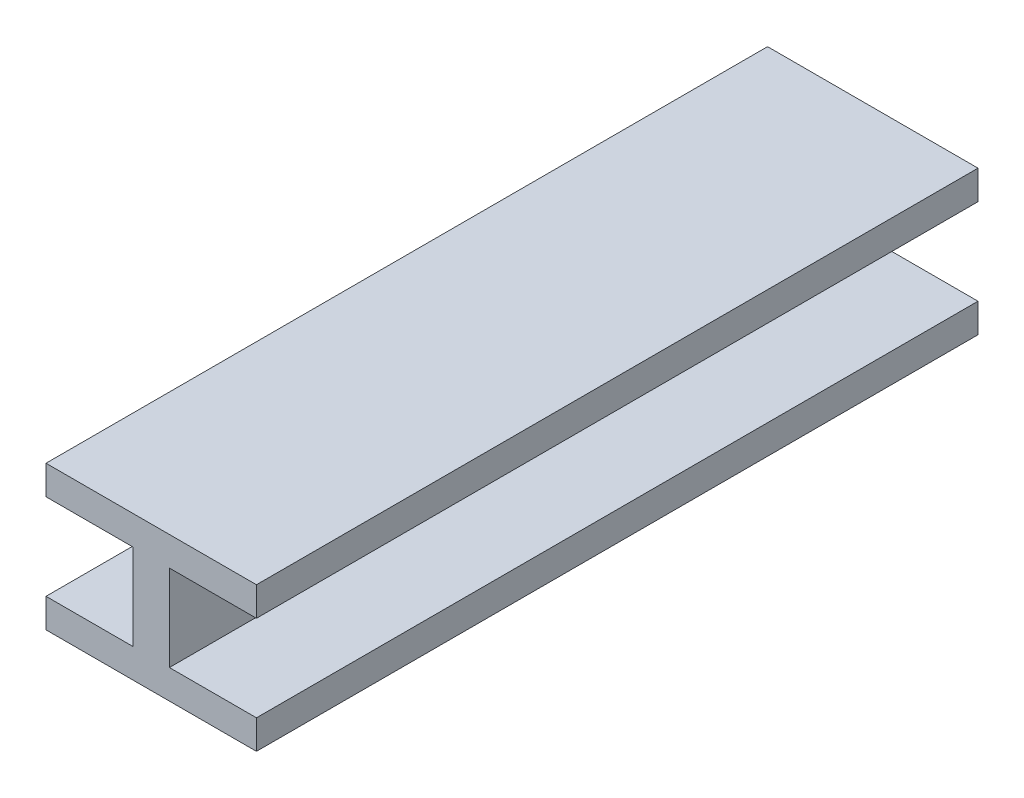
from build123d import *

# Parameters (mm, degrees)
BOSS_EXTRUDE2_DEPTH = 76.2


with BuildPart() as part:
    # Sketch1 → Boss-Extrude2 (new, symmetric)
    with BuildSketch(Plane.XY):
        Polygon((3.837185938, 9.1005025), (3.837185938, -9.1005025), (22.225, -9.1005025), (22.225, -15.24), (-22.225, -15.24), (-22.225, -9.1005025), (-3.837185937, -9.1005025), (-3.837185937, 9.1005025), (-22.225, 9.1005025), (-22.225, 15.24), (22.225, 15.24), (22.225, 9.1005025), align=None)
    extrude(amount=BOSS_EXTRUDE2_DEPTH, both=True)


solid = part.part
